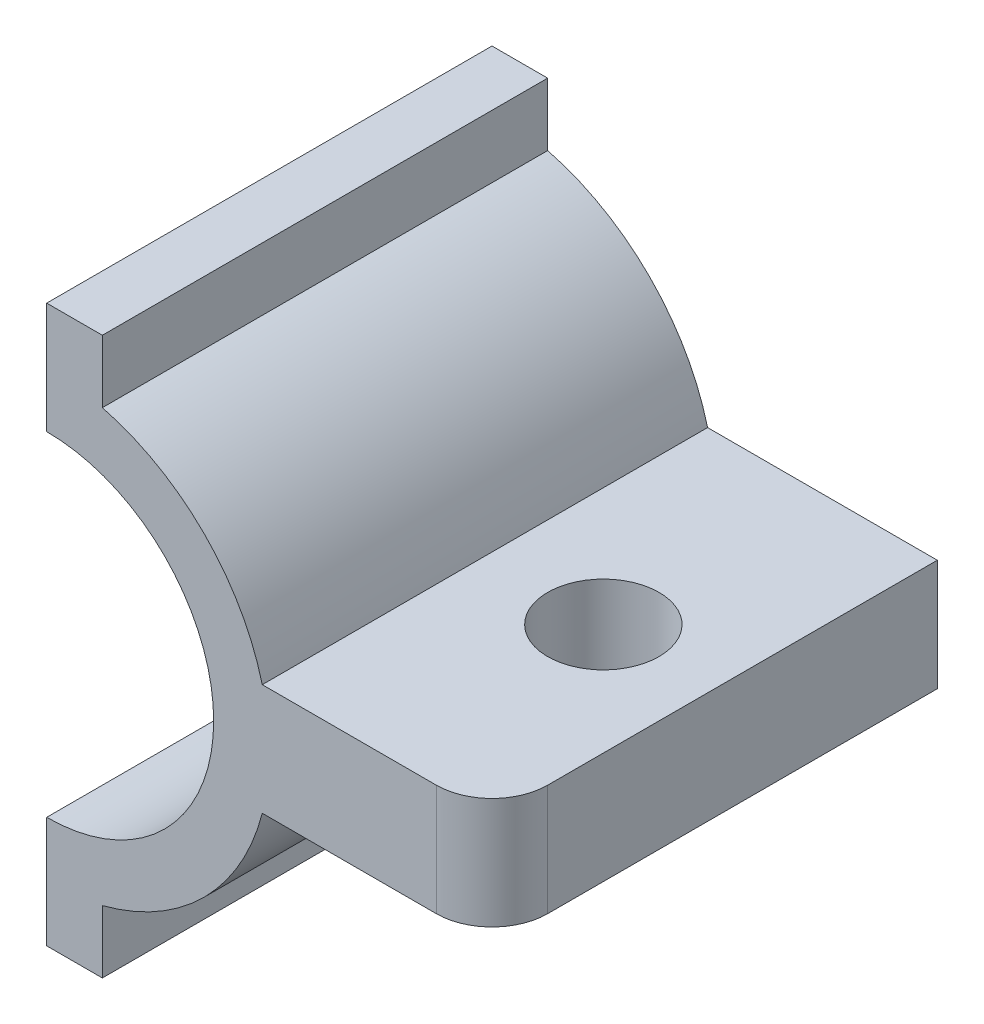
from build123d import *

# Parameters (mm, degrees)
EXTRUDE_1_DEPTH     = 80
SKETCH_2_R          = 10
CUT_EXTRUDE_1_DEPTH = 129.062484749
FILLET_1_R          = 10


with BuildPart() as part:
    # 草圖1 → 填料-伸長1 (new body)
    with BuildSketch(Plane.XY):
        with BuildLine():
            Line((0, -30), (0, -50))
            Line((0, -50), (10, -50))
            Line((10, -50), (10, -38.729833462))
            ThreePointArc((10, -38.729833462), (28.284271247, -28.284271247), (38.729833462, -10))
            Line((38.729833462, -10), (80, -10))
            Line((80, -10), (80, 10))
            Line((80, 10), (38.729833462, 10))
            ThreePointArc((38.729833462, 10), (28.284271247, 28.284271247), (10, 38.729833462))
            Line((10, 38.729833462), (10, 50))
            Line((10, 50), (0, 50))
            Line((0, 50), (0, 30))
            ThreePointArc((0, 30), (30, 0), (0, -30))
        make_face()
    extrude(amount=EXTRUDE_1_DEPTH)

    # 草圖2 → 除料-伸長1 (cut, through all)
    with BuildSketch(Plane.XZ.offset(10)):
        with Locations((60, 40)):
            Circle(SKETCH_2_R)
    extrude(amount=-CUT_EXTRUDE_1_DEPTH, mode=Mode.SUBTRACT)

    # 圓角1
    fillet_1_edges = [part.edges().sort_by_distance(p)[0] for p in [
        (80, 0, 80),
    ]]
    fillet(fillet_1_edges, radius=FILLET_1_R)


solid = part.part
